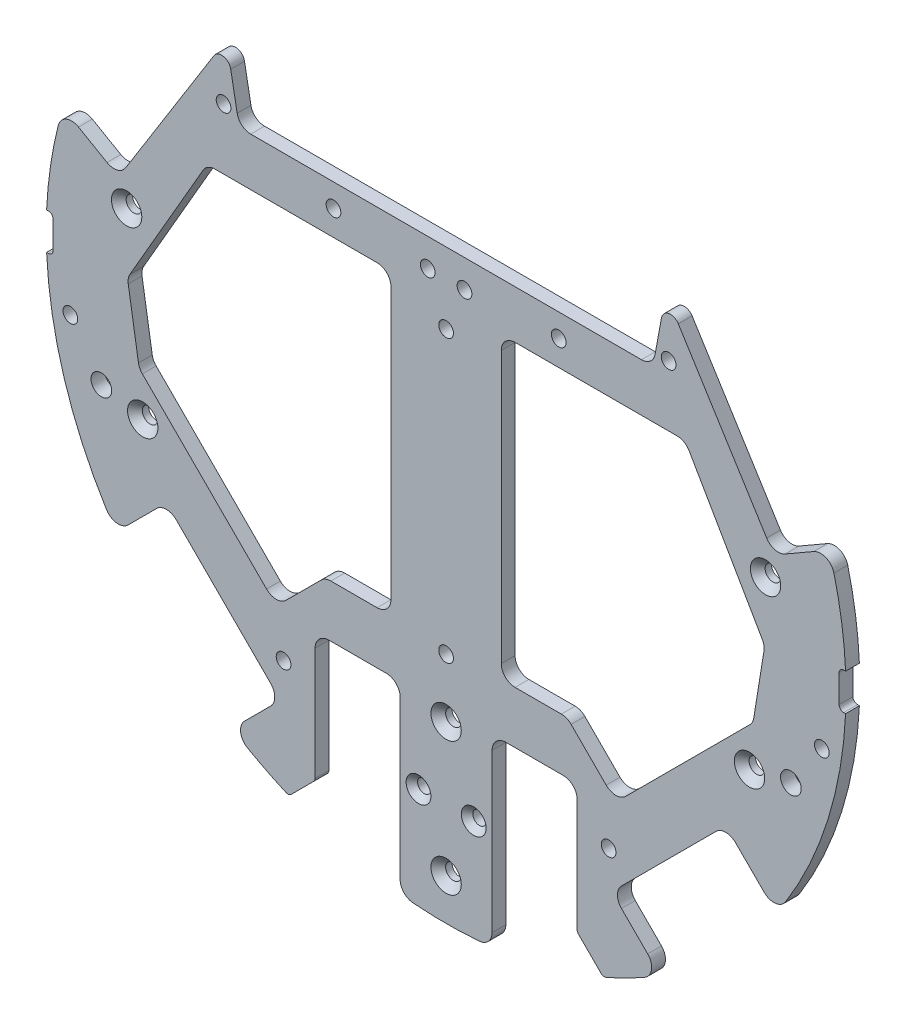
from build123d import *

# Parameters (mm, degrees)
EXTRUDE_1_DEPTH           = 3
CUT_EXTRUDE_1_REACH       = 127.841
FILLET_1_R                = 3
FILLET_3_R                = 3
CUT_EXTRUDE_2_REACH       = 127.841
SKETCH_3_R                = 1.6
FILLET_4_R                = 2
CUT_EXTRUDE_4_REACH       = 127.841
SKETCH_5_R                = 1.6
CUT_EXTRUDE_5_REACH       = 127.841
SKETCH_6_R                = 2.25
HOLE_WIZARD_1_D           = 3.4
HOLE_WIZARD_1_DEPTH       = 3
HOLE_WIZARD_1_CSINK_D     = 6.6
HOLE_WIZARD_1_CSINK_ANGLE = 90
HOLE_WIZARD_1_TIP         = 1.021463052
CUT_EXTRUDE_6_REACH       = 127.841
SKETCH_9_R                = 1.6
SKETCH_10_R               = 107.153913746
SKETCH_10_R_2             = 87
CUT_EXTRUDE_7_DEPTH       = 10
FILLET_5_R                = 3
SKETCH_12_W               = 2.492222484
SKETCH_12_H               = 8
CUT_EXTRUDE_8_DEPTH       = 10
FILLET_6_R                = 1
FILLET_7_R                = 3
HOLE_WIZARD_2_D           = 3.4
HOLE_WIZARD_2_DEPTH       = 3
HOLE_WIZARD_2_CSINK_D     = 6.6
HOLE_WIZARD_2_CSINK_ANGLE = 90
HOLE_WIZARD_2_TIP         = 1.021463052
HOLE_WIZARD_3_D           = 2.9
HOLE_WIZARD_3_DEPTH       = 3
HOLE_WIZARD_3_CSINK_D     = 5.4
HOLE_WIZARD_3_CSINK_ANGLE = 90
HOLE_WIZARD_3_TIP         = 0.871247898
CUT_EXTRUDE_10_DEPTH      = 10
FILLET_8_R                = 1
SKETCH1_R                 = 1.6
EXTRUDE1_DEPTH            = 10


with BuildPart() as part:
    # 草图1 → 凸台-拉伸1 (new body)
    with BuildSketch(Plane.XY):
        with BuildLine():
            Line((-45, 40.484634583), (-47.790898075, 55.614169672))
            Line((-47.790898075, 55.614169672), (-71.258078067, 18.058831232))
            Line((-71.258078067, 18.058831232), (-85.105103955, 26.040761909))
            ThreePointArc((-85.105103955, 26.040761909), (-87.951877875, -13.618633494), (-73.244121351, -50.559852526))
            Line((-73.244121351, -50.559852526), (-60.839609095, -38.155340271))
            Line((-60.839609095, -38.155340271), (-36.030129611, -62.964819755))
            Line((-36.030129611, -62.964819755), (-48.007288857, -74.941979001))
            ThreePointArc((-48.007288857, -74.941979001), (-38.539553852, -80.222832092), (-28.5, -84.313403442))
            Line((-28.5, -84.313403442), (-28.5, -46.350874392))
            Line((-28.5, -46.350874392), (-10, -46.350874392))
            Line((-10, -46.350874392), (-10, -88.350874392))
            ThreePointArc((-10, -88.350874392), (-5.007949588, -88.773855648), (0, -88.914998767))
            Line((0, -88.914998767), (0, 40.484634583))
            Line((0, 40.484634583), (-45, 40.484634583))
        make_face()
    extrude(amount=EXTRUDE_1_DEPTH)

    # 草图2 → 切除-拉伸1 (cut, up to next)
    with BuildSketch(Plane.XY.offset(3), mode=Mode.PRIVATE) as cut_extrude_1_sk1:
        Polygon((-12, 0), (-12, 30), (-52, 30), (-69.320508076, 0), (-66.769463395, -15.795321176), (-36.939246535, -45.625538036), (-26.313708499, -35), (-12, -35), align=None)
    cut_extrude_1_tool1 = extrude(cut_extrude_1_sk1.sketch, amount=-CUT_EXTRUDE_1_REACH, mode=Mode.PRIVATE) & part.part
    add(cut_extrude_1_tool1.solids().sort_by_distance((-37.08097, -3.648282, 3))[0], mode=Mode.SUBTRACT)

    # 圆角1
    fillet_1_edges = [part.edges().sort_by_distance(p)[0] for p in [
        (-71.258078067, 18.058831232, 1.5),
        (-45, 40.484634583, 1.5),
        (-36.030129611, -62.964819755, 1.5),
        (-60.839609095, -38.155340271, 1.5),
    ]]
    fillet(fillet_1_edges, radius=FILLET_1_R)

    # 圆角3
    fillet_3_edges = [part.edges().sort_by_distance(p)[0] for p in [
        (-66.769463395, -15.795321176, 1.5),
        (-69.320508076, 0, 1.5),
        (-52, 30, 1.5),
        (-12, 30, 1.5),
        (-12, -35, 1.5),
        (-26.313708499, -35, 1.5),
        (-36.939246535, -45.625538036, 1.5),
    ]]
    fillet(fillet_3_edges, radius=FILLET_3_R)

    # 镜向2: part across plane


with BuildPart() as part_1:
    add(part.part)
    add(part.part.mirror(Plane(origin=(0, 40.484634583, 3), x_dir=(0, 0, 1), z_dir=(-1, 0, 0))))

    # 草图3 → 切除-拉伸2 (cut, up to next)
    with BuildSketch(Plane.XY.offset(3), mode=Mode.PRIVATE) as cut_extrude_2_sk1:
        with Locations((-81.739855024, -13.201505688)):
            Circle(SKETCH_3_R)
    cut_extrude_2_tool1 = extrude(cut_extrude_2_sk1.sketch, amount=-CUT_EXTRUDE_2_REACH, mode=Mode.PRIVATE) & part_1.part
    # 草图3 → 切除-拉伸2 (cut, up to next)
    with BuildSketch(Plane.XY.offset(3), mode=Mode.PRIVATE) as cut_extrude_2_sk2:
        with Locations((0, -36.25)):
            Circle(SKETCH_3_R)
    cut_extrude_2_tool2 = extrude(cut_extrude_2_sk2.sketch, amount=-CUT_EXTRUDE_2_REACH, mode=Mode.PRIVATE) & part_1.part
    # 草图3 → 切除-拉伸2 (cut, up to next)
    with BuildSketch(Plane.XY.offset(3), mode=Mode.PRIVATE) as cut_extrude_2_sk3:
        with Locations((0, 25)):
            Circle(SKETCH_3_R)
    cut_extrude_2_tool3 = extrude(cut_extrude_2_sk3.sketch, amount=-CUT_EXTRUDE_2_REACH, mode=Mode.PRIVATE) & part_1.part
    # 草图3 → 切除-拉伸2 (cut, up to next)
    with BuildSketch(Plane.XY.offset(3), mode=Mode.PRIVATE) as cut_extrude_2_sk4:
        with Locations((81.739855024, -13.201505688)):
            Circle(SKETCH_3_R)
    cut_extrude_2_tool4 = extrude(cut_extrude_2_sk4.sketch, amount=-CUT_EXTRUDE_2_REACH, mode=Mode.PRIVATE) & part_1.part
    add(cut_extrude_2_tool1.solids().sort_by_distance((-81.739855, -13.201506, 3))[0], mode=Mode.SUBTRACT)
    add(cut_extrude_2_tool2.solids().sort_by_distance((0, -36.25, 3))[0], mode=Mode.SUBTRACT)
    add(cut_extrude_2_tool3.solids().sort_by_distance((0, 25, 3))[0], mode=Mode.SUBTRACT)
    add(cut_extrude_2_tool4.solids().sort_by_distance((81.739855, -13.201506, 3))[0], mode=Mode.SUBTRACT)

    # 圆角4
    fillet_4_edges = [part_1.edges().sort_by_distance(p)[0] for p in [
        (47.790898075, 55.614169672, 1.5),
        (-47.790898075, 55.614169672, 1.5),
    ]]
    fillet(fillet_4_edges, radius=FILLET_4_R)

    # 草图5 → 切除-拉伸4 (cut, up to next)
    with BuildSketch(Plane.XY.offset(3), mode=Mode.PRIVATE) as cut_extrude_4_sk1:
        with Locations((-4, 34.39963335)):
            Circle(SKETCH_5_R)
    cut_extrude_4_tool1 = extrude(cut_extrude_4_sk1.sketch, amount=-CUT_EXTRUDE_4_REACH, mode=Mode.PRIVATE) & part_1.part
    # 草图5 → 切除-拉伸4 (cut, up to next)
    with BuildSketch(Plane.XY.offset(3), mode=Mode.PRIVATE) as cut_extrude_4_sk2:
        with Locations((4, 34.39963335)):
            Circle(SKETCH_5_R)
    cut_extrude_4_tool2 = extrude(cut_extrude_4_sk2.sketch, amount=-CUT_EXTRUDE_4_REACH, mode=Mode.PRIVATE) & part_1.part
    add(cut_extrude_4_tool1.solids().sort_by_distance((-4, 34.399633, 3))[0], mode=Mode.SUBTRACT)
    add(cut_extrude_4_tool2.solids().sort_by_distance((4, 34.399633, 3))[0], mode=Mode.SUBTRACT)

    # 草图6 → 切除-拉伸5 (cut, up to next)
    with BuildSketch(Plane.XY.offset(3), mode=Mode.PRIVATE) as cut_extrude_5_sk1:
        with Locations((-75, -23)):
            Circle(SKETCH_6_R)
    cut_extrude_5_tool1 = extrude(cut_extrude_5_sk1.sketch, amount=-CUT_EXTRUDE_5_REACH, mode=Mode.PRIVATE) & part_1.part
    # 草图6 → 切除-拉伸5 (cut, up to next)
    with BuildSketch(Plane.XY.offset(3), mode=Mode.PRIVATE) as cut_extrude_5_sk2:
        with Locations((75, -23)):
            Circle(SKETCH_6_R)
    cut_extrude_5_tool2 = extrude(cut_extrude_5_sk2.sketch, amount=-CUT_EXTRUDE_5_REACH, mode=Mode.PRIVATE) & part_1.part
    add(cut_extrude_5_tool1.solids().sort_by_distance((-75, -23, 3))[0], mode=Mode.SUBTRACT)
    add(cut_extrude_5_tool2.solids().sort_by_distance((75, -23, 3))[0], mode=Mode.SUBTRACT)

    # 打孔尺寸(%根据十字)槽沉头木螺钉的类型1
    with Locations(Plane(origin=(-69.5, 13, 3), x_dir=(1, 0, 0), z_dir=(0, 0, 1))):
        with Locations((0, 0), (3.5, -38), (139, 0), (135.5, -38)):
            CounterSinkHole(HOLE_WIZARD_1_D / 2, HOLE_WIZARD_1_CSINK_D / 2, depth=HOLE_WIZARD_1_DEPTH, counter_sink_angle=HOLE_WIZARD_1_CSINK_ANGLE)
            with Locations((0, 0, -(HOLE_WIZARD_1_DEPTH + HOLE_WIZARD_1_TIP / 2))):  # 118° drill point
                Cone(0, HOLE_WIZARD_1_D / 2, HOLE_WIZARD_1_TIP, mode=Mode.SUBTRACT)

    # 草图9 → 切除-拉伸6 (cut, up to next)
    with BuildSketch(Plane.XY.offset(3), mode=Mode.PRIVATE) as cut_extrude_6_sk1:
        with Locations((-48.412128424, 43.22221775)):
            Circle(SKETCH_9_R)
    cut_extrude_6_tool1 = extrude(cut_extrude_6_sk1.sketch, amount=-CUT_EXTRUDE_6_REACH, mode=Mode.PRIVATE) & part_1.part
    # 草图9 → 切除-拉伸6 (cut, up to next)
    with BuildSketch(Plane.XY.offset(3), mode=Mode.PRIVATE) as cut_extrude_6_sk2:
        with Locations((-35.355339059, -55.154328933)):
            Circle(SKETCH_9_R)
    cut_extrude_6_tool2 = extrude(cut_extrude_6_sk2.sketch, amount=-CUT_EXTRUDE_6_REACH, mode=Mode.PRIVATE) & part_1.part
    # 草图9 → 切除-拉伸6 (cut, up to next)
    with BuildSketch(Plane.XY.offset(3), mode=Mode.PRIVATE) as cut_extrude_6_sk3:
        with Locations((48.412128424, 43.22221775)):
            Circle(SKETCH_9_R)
    cut_extrude_6_tool3 = extrude(cut_extrude_6_sk3.sketch, amount=-CUT_EXTRUDE_6_REACH, mode=Mode.PRIVATE) & part_1.part
    # 草图9 → 切除-拉伸6 (cut, up to next)
    with BuildSketch(Plane.XY.offset(3), mode=Mode.PRIVATE) as cut_extrude_6_sk4:
        with Locations((35.355339059, -55.154328933)):
            Circle(SKETCH_9_R)
    cut_extrude_6_tool4 = extrude(cut_extrude_6_sk4.sketch, amount=-CUT_EXTRUDE_6_REACH, mode=Mode.PRIVATE) & part_1.part
    add(cut_extrude_6_tool1.solids().sort_by_distance((-48.412128, 43.222218, 3))[0], mode=Mode.SUBTRACT)
    add(cut_extrude_6_tool2.solids().sort_by_distance((-35.355339, -55.154329, 3))[0], mode=Mode.SUBTRACT)
    add(cut_extrude_6_tool3.solids().sort_by_distance((48.412128, 43.222218, 3))[0], mode=Mode.SUBTRACT)
    add(cut_extrude_6_tool4.solids().sort_by_distance((35.355339, -55.154329, 3))[0], mode=Mode.SUBTRACT)

    # 草图10 → 切除-拉伸7 (cut)
    with BuildSketch(Plane.XY.offset(3)):
        Circle(SKETCH_10_R)
        Circle(SKETCH_10_R_2, mode=Mode.SUBTRACT)
    extrude(amount=-CUT_EXTRUDE_7_DEPTH, mode=Mode.SUBTRACT)

    # 圆角5
    fillet_5_edges = [part_1.edges().sort_by_distance(p)[0] for p in [
        (83.326083977, 25.015269919, 1.5),
        (-71.80580935, -49.121540525, 1.5),
        (-46.558737732, -73.493427875, 1.5),
        (46.558737732, -73.493427875, 1.5),
        (71.80580935, -49.121540525, 1.5),
        (-83.326083977, 25.015269919, 1.5),
    ]]
    fillet(fillet_5_edges, radius=FILLET_5_R)

    # 草图12 → 切除-拉伸8 (cut)
    with BuildSketch(Plane.XY.offset(3)):
        with Locations((-86.746111242, 0)):
            Rectangle(SKETCH_12_W, SKETCH_12_H)
        with Locations((86.746111242, 0)):
            Rectangle(SKETCH_12_W, SKETCH_12_H)
    extrude(amount=-CUT_EXTRUDE_8_DEPTH, mode=Mode.SUBTRACT)

    # 圆角6
    fillet_6_edges = [part_1.edges().sort_by_distance(p)[0] for p in [
        (-85.5, 4, 1.5),
        (-85.5, -4, 1.5),
        (85.5, -4, 1.5),
        (85.5, 4, 1.5),
    ]]
    fillet(fillet_6_edges, radius=FILLET_6_R)

    # 圆角7
    fillet_7_edges = [part_1.edges().sort_by_distance(p)[0] for p in [
        (28.5, -46.350874392, 1.5),
        (10, -46.350874392, 1.5),
        (-10, -46.350874392, 1.5),
        (-28.5, -46.350874392, 1.5),
        (-28.5, -82.199452553, 1.5),
        (-10, -86.423376467, 1.5),
        (10, -86.423376467, 1.5),
        (28.5, -82.199452553, 1.5),
    ]]
    fillet(fillet_7_edges, radius=FILLET_7_R)

    # 打孔尺寸(%根据十字)槽沉头木螺钉的类型2
    with Locations(Plane(origin=(0, -49, 3), x_dir=(1, 0, 0), z_dir=(0, 0, 1))):
        with Locations((0, 0), (0, -29)):
            CounterSinkHole(HOLE_WIZARD_2_D / 2, HOLE_WIZARD_2_CSINK_D / 2, depth=HOLE_WIZARD_2_DEPTH, counter_sink_angle=HOLE_WIZARD_2_CSINK_ANGLE)
            with Locations((0, 0, -(HOLE_WIZARD_2_DEPTH + HOLE_WIZARD_2_TIP / 2))):  # 118° drill point
                Cone(0, HOLE_WIZARD_2_D / 2, HOLE_WIZARD_2_TIP, mode=Mode.SUBTRACT)

    # 打孔尺寸(%根据十字)槽沉头木螺钉的类型3
    with Locations(Plane(origin=(-6, -64.696867821, 3), x_dir=(1, 0, 0), z_dir=(0, 0, 1))):
        with Locations((0, 0), (12, 0)):
            CounterSinkHole(HOLE_WIZARD_3_D / 2, HOLE_WIZARD_3_CSINK_D / 2, depth=HOLE_WIZARD_3_DEPTH, counter_sink_angle=HOLE_WIZARD_3_CSINK_ANGLE)
            with Locations((0, 0, -(HOLE_WIZARD_3_DEPTH + HOLE_WIZARD_3_TIP / 2))):  # 118° drill point
                Cone(0, HOLE_WIZARD_3_D / 2, HOLE_WIZARD_3_TIP, mode=Mode.SUBTRACT)

    # 草图17 → 切除-拉伸10 (cut)
    with BuildSketch(Plane.XY.offset(3)):
        Polygon((-28.5, -84.313403442), (-28.5, -74.313403442), (-35.708850961, -81.522254403), align=None)
        Polygon((35.708850961, -81.522254403), (28.5, -84.313403442), (28.5, -74.313403442), align=None)
    extrude(amount=-CUT_EXTRUDE_10_DEPTH, mode=Mode.SUBTRACT)

    # 圆角8
    fillet_8_edges = [part_1.edges().sort_by_distance(p)[0] for p in [
        (-34.18780779, -80.001211232, 1.5),
        (-28.5, -74.313403442, 1.5),
        (34.18780779, -80.001211232, 1.5),
        (28.5, -74.313403442, 1.5),
    ]]
    fillet(fillet_8_edges, radius=FILLET_8_R)

    # Sketch1 → Extrude1 (cut)
    with BuildSketch(Plane.XY.offset(3)):
        with Locations((24.5, 35.484634583)):
            Circle(SKETCH1_R)
        with Locations((-24.5, 35.484634583)):
            Circle(SKETCH1_R)
    extrude(amount=-EXTRUDE1_DEPTH, mode=Mode.SUBTRACT)


solid = part_1.part
